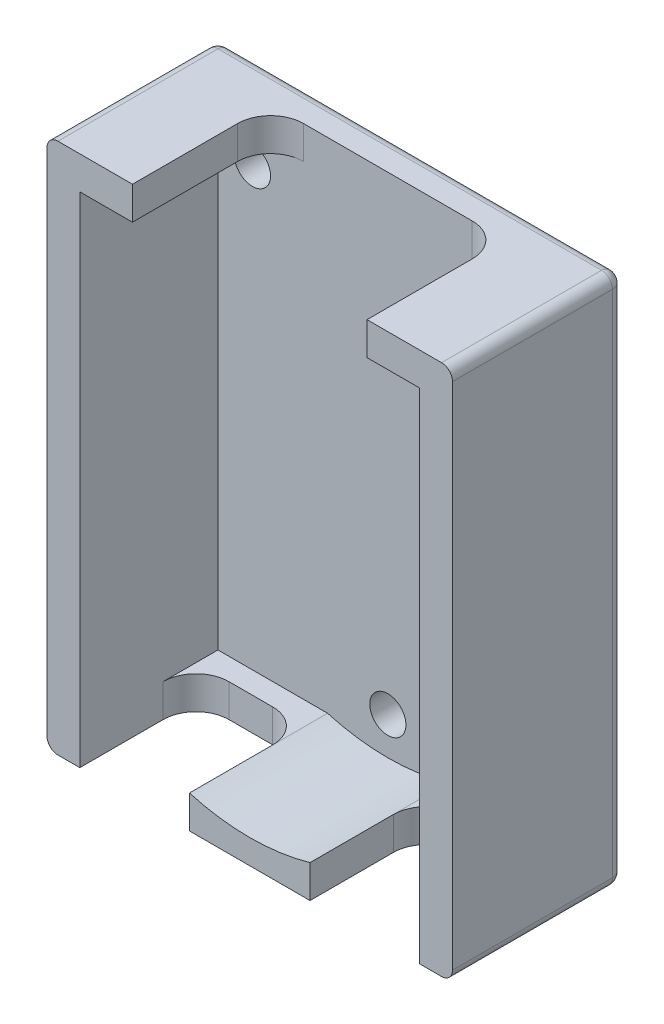
from build123d import *

# Parameters (mm, degrees)
SKETCH1_W           = 31
SKETCH1_H           = 42.5
BOSS_EXTRUDE1_DEPTH = 3
SKETCH2_W           = 37
SKETCH2_H           = 48.5
SKETCH2_W_2         = 31
SKETCH2_H_2         = 42.5
BOSS_EXTRUDE2_DEPTH = 15.6
CUT_EXTRUDE1_REACH  = 36.259
SKETCH3_R           = 1.65
CUT_EXTRUDE2_REACH  = 56.202
SKETCH4_W           = 21.4
SKETCH4_H           = 12.6
CUT_EXTRUDE3_REACH  = 56.202
SKETCH5_W           = 10
SKETCH5_H           = 10.6
CUT_EXTRUDE5_REACH  = 36.259
FILLET4_R           = 1
FILLET1_R           = 3


with BuildPart() as part:
    # Sketch1 → Boss-Extrude1 (new body)
    with BuildSketch(Plane.XY):
        Rectangle(SKETCH1_W, SKETCH1_H)
    extrude(amount=BOSS_EXTRUDE1_DEPTH)

    # Sketch2 → Boss-Extrude2 (add)
    with BuildSketch(Plane.XY):
        Rectangle(SKETCH2_W, SKETCH2_H)
        Rectangle(SKETCH2_W_2, SKETCH2_H_2, mode=Mode.SUBTRACT)
    extrude(amount=BOSS_EXTRUDE2_DEPTH)

    # Sketch3 → Cut-Extrude1 (cut, up to next)
    with BuildSketch(Plane(origin=(0, 0, 0), x_dir=(-1, 0, 0), z_dir=(0, 0, -1)), mode=Mode.PRIVATE) as cut_extrude1_sk1:
        with Locations((12.35, 18.6)):
            Circle(SKETCH3_R)
    cut_extrude1_tool1 = extrude(cut_extrude1_sk1.sketch, amount=-CUT_EXTRUDE1_REACH, mode=Mode.PRIVATE) & part.part
    # Sketch3 → Cut-Extrude1 (cut, up to next)
    with BuildSketch(Plane(origin=(0, 0, 0), x_dir=(-1, 0, 0), z_dir=(0, 0, -1)), mode=Mode.PRIVATE) as cut_extrude1_sk2:
        with Locations((0, -18.6)):
            Circle(SKETCH3_R)
    cut_extrude1_tool2 = extrude(cut_extrude1_sk2.sketch, amount=-CUT_EXTRUDE1_REACH, mode=Mode.PRIVATE) & part.part
    cut_extrude1_1 = cut_extrude1_tool1.solids().sort_by_distance((-12.35, 18.6, 0))[0]
    add(cut_extrude1_1, mode=Mode.SUBTRACT)
    cut_extrude1_2 = cut_extrude1_tool2.solids().sort_by_distance((0, -18.6, 0))[0]
    add(cut_extrude1_2, mode=Mode.SUBTRACT)
    cut_extrude1 = cut_extrude1_1 + cut_extrude1_2  # Cut-Extrude1 as one shape, for the pattern or mirror that repeats it

    # Mirror1: Cut-Extrude1 across plane
    add(cut_extrude1.mirror(Plane(origin=(0, 0, 0), x_dir=(0, 0, 1), z_dir=(1, 0, 0))), mode=Mode.SUBTRACT)

    # Sketch4 → Cut-Extrude2 (cut, up to next)
    with BuildSketch(Plane(origin=(0, 24.25, 0), x_dir=(1, 0, 0), z_dir=(0, 1, 0)), mode=Mode.PRIVATE) as cut_extrude2_sk1:
        with Locations((0, -9.3)):
            Rectangle(SKETCH4_W, SKETCH4_H)
    cut_extrude2_tool1 = extrude(cut_extrude2_sk1.sketch, amount=-CUT_EXTRUDE2_REACH, mode=Mode.PRIVATE) & part.part
    add(cut_extrude2_tool1.solids().sort_by_distance((0, 24.25, 9.3))[0], mode=Mode.SUBTRACT)

    # Sketch5 → Cut-Extrude3 (cut, up to next)
    with BuildSketch(Plane.XZ.offset(24.25), mode=Mode.PRIVATE) as cut_extrude3_sk1:
        with Locations((10.5, 10.3)):
            Rectangle(SKETCH5_W, SKETCH5_H)
    cut_extrude3_tool1 = extrude(cut_extrude3_sk1.sketch, amount=-CUT_EXTRUDE3_REACH, mode=Mode.PRIVATE) & part.part
    cut_extrude3 = cut_extrude3_tool1.solids().sort_by_distance((10.5, -24.25, 10.3))[0]
    add(cut_extrude3, mode=Mode.SUBTRACT)

    # Mirror2: Cut-Extrude3 across plane
    add(cut_extrude3.mirror(Plane(origin=(0, 0, 0), x_dir=(0, 0, 1), z_dir=(1, 0, 0))), mode=Mode.SUBTRACT)

    # Cut-Extrude5: up to this face of the body (flat: up to its plane)
    cut_extrude5_end = Plane(part.part.faces().sort_by_distance((0, 0.959753002, 3))[0])
    # Sketch6 → Cut-Extrude5 (cut, up to the picked face)
    with BuildSketch(Plane.XY.offset(15.6), mode=Mode.PRIVATE) as cut_extrude5_sk1:
        with BuildLine():
            Line((5.5, -21.25), (-5.5, -21.25))
            ThreePointArc((-5.5, -21.25), (0, -22.021115477), (5.5, -21.25))
        make_face()
    cut_extrude5_tool1 = split(extrude(cut_extrude5_sk1.sketch, amount=-CUT_EXTRUDE5_REACH, mode=Mode.PRIVATE), bisect_by=cut_extrude5_end, keep=Keep.BOTH, mode=Mode.PRIVATE)
    add(cut_extrude5_tool1.solids().sort_by(Axis((0, -21.558962, 15.6), (0, 0, -1)))[0], mode=Mode.SUBTRACT)

    # Fillet4
    fillet4_edges = [part.edges().sort_by_distance(p)[0] for p in [
        (0, -24.25, 0),
        (-18.5, -24.25, 7.8),
        (18.5, 0, 0),
        (18.5, -24.25, 7.8),
        (0, 24.25, 0),
        (18.5, 24.25, 7.8),
        (-18.5, 0, 0),
        (-18.5, 24.25, 7.8),
    ]]
    fillet(fillet4_edges, radius=FILLET4_R)

    # Fillet1
    fillet1_edges = [part.edges().sort_by_distance(p)[0] for p in [
        (10.7, 22.75, 3),
        (-10.7, 22.75, 3),
        (15.5, -22.75, 5),
        (5.5, -22.75, 5),
        (-5.5, -22.75, 5),
        (-15.5, -22.75, 5),
    ]]
    fillet(fillet1_edges, radius=FILLET1_R)


solid = part.part
